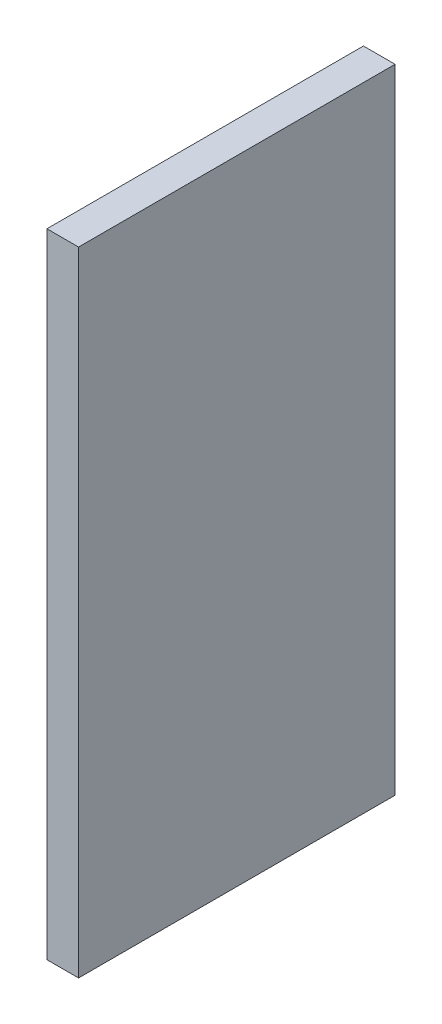
from build123d import *

# Parameters (mm, degrees)
SKETCH1_W           = 40
SKETCH1_H           = 80
BOSS_EXTRUDE1_DEPTH = 4


with BuildPart() as part:
    # Sketch1 → Boss-Extrude1 (new body)
    with BuildSketch(Plane(origin=(0, 0, 0), x_dir=(0, 0, -1), z_dir=(1, 0, 0))):
        with Locations((0, -82.5)):
            Rectangle(SKETCH1_W, SKETCH1_H)
    extrude(amount=BOSS_EXTRUDE1_DEPTH)


solid = part.part
